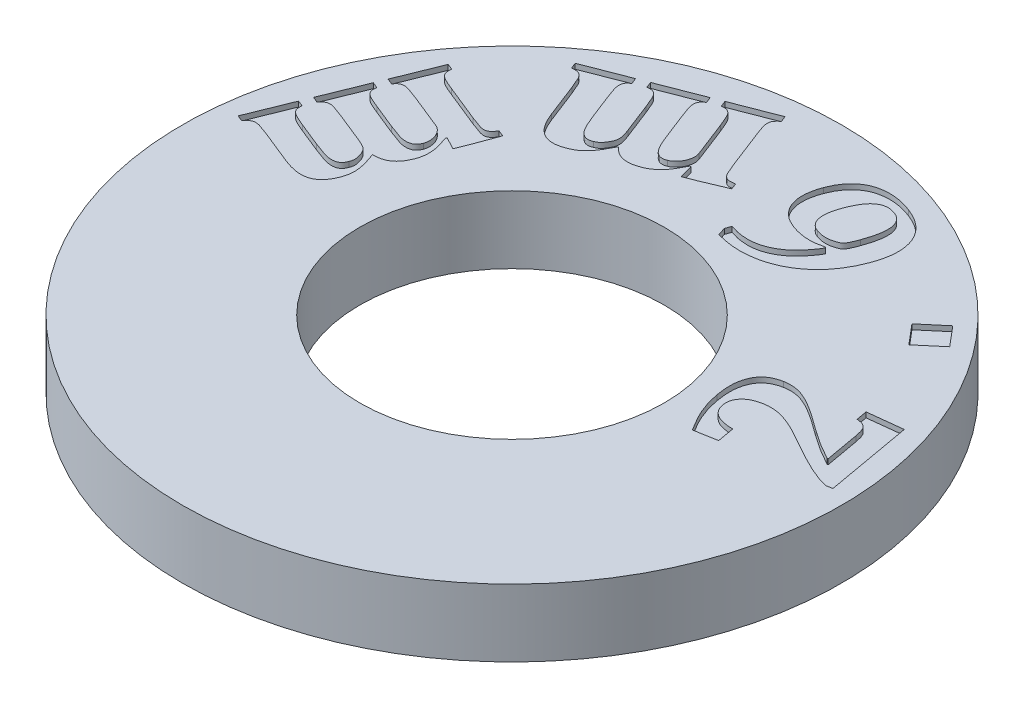
from build123d import *

# Parameters (mm, degrees)
SKETCH1_R           = 12.7
BOSS_EXTRUDE1_DEPTH = 2.6
SKETCH2_R           = 5.8674
CUT_EXTRUDE1_DEPTH  = 19.14772713
CUT_EXTRUDE2_DEPTH  = 0.2


with BuildPart() as part:
    # Sketch1 → Boss-Extrude1 (new body)
    with BuildSketch(Plane(origin=(0, 0, 0), x_dir=(1, 0, 0), z_dir=(0, 1, 0))):
        with Locations(Location((0, 0, 0), (0, 0, 270))):
            Circle(SKETCH1_R)
    extrude(amount=BOSS_EXTRUDE1_DEPTH)

    # Sketch2 → Cut-Extrude1 (cut, through all)
    with BuildSketch(Plane(origin=(0, 0, 0), x_dir=(-1, 0, 0), z_dir=(0, -1, 0))):
        with Locations(Location((0, 0, 0), (0, 0, 90))):
            Circle(SKETCH2_R)
    extrude(amount=-CUT_EXTRUDE1_DEPTH, mode=Mode.SUBTRACT)

    # Sketch4 → Cut-Extrude2 (cut)
    # profile 1 of 5: a face of its own
    with BuildSketch(Plane(origin=(0, 2.6, 0), x_dir=(1, 0, 0), z_dir=(0, 1, 0))):
        with BuildLine():
            add(Edge.make_bspline(
                [(10.657175979, 2.594019097), (10.65013064, 2.630831583), (10.636969406, 2.699600141), (10.614138172, 2.794705295), (10.589733244, 2.874375061), (10.561272904, 2.939067494), (10.531020983, 2.99353319), (10.494812939, 3.038568652), (10.452899957, 3.075923763), (10.405274192, 3.106357847), (10.349988215, 3.13102197), (10.285264647, 3.148965447), (10.210866978, 3.163737215), (10.157483095, 3.168212073), (10.129111743, 3.170590278)],
                knots=[0, 0, 0, 0, 1.540311631, 2.877420744, 4.019047234, 4.959142214, 5.777829076, 6.572764425, 7.321593786, 8.075735676, 8.887004588, 9.799891039, 10.830732, 12, 12, 12, 12], degree=3))
            Line((10.129111743, 3.170590278), (10.054146465, 3.590616319))
            Line((10.054146465, 3.590616319), (11.377063132, 3.739444444))
            Line((11.377063132, 3.739444444), (11.972375632, 0.394670139))
            Line((11.972375632, 0.394670139), (11.73094334, 0.351675347))
            add(Edge.make_bspline(
                [(11.73094334, 0.351675347), (11.666021298, 0.368480839), (11.531212131, 0.403377067), (11.326414737, 0.474445449), (11.110180307, 0.559425855), (10.882988887, 0.660070864), (10.645158868, 0.776715276), (10.394395938, 0.905922065), (10.131048372, 1.048986702), (9.9528541, 1.151989425), (9.861221118, 1.204956597)],
                knots=[0, 0, 0, 0, 0.780349875, 1.620379058, 2.521161756, 3.484490423, 4.511830184, 5.604229563, 6.768021061, 8, 8, 8, 8], degree=3))
            add(Edge.make_bspline(
                [(9.861221118, 1.204956597), (9.776443058, 1.253652173), (9.615930318, 1.345848907), (9.387059411, 1.473484458), (9.181803351, 1.579516376), (8.998168575, 1.667527983), (8.830111188, 1.739289307), (8.671736429, 1.799305225), (8.518737568, 1.8433924), (8.371972803, 1.879309741), (8.228064992, 1.900559713), (8.085286383, 1.908174145), (7.94232826, 1.903319711), (7.848085123, 1.889024598), (7.80077841, 1.881848958)],
                knots=[0, 0, 0, 0, 1.588748718, 3.008023671, 4.257940554, 5.342391522, 6.316243066, 7.226933507, 8.092329584, 8.902015177, 9.680651395, 10.452110241, 11.223014214, 12, 12, 12, 12], degree=3))
            add(Edge.make_bspline(
                [(7.80077841, 1.881848958), (7.737810367, 1.868570311), (7.617604939, 1.843221491), (7.453187274, 1.778906093), (7.312606985, 1.697337928), (7.217707497, 1.610851073), (7.156248473, 1.534763117), (7.11835972, 1.475393068), (7.090083841, 1.412684467), (7.066648765, 1.348152535), (7.054692086, 1.279597589), (7.047209551, 1.208811476), (7.049839269, 1.135133242), (7.057246716, 1.085833888), (7.061047507, 1.060538194)],
                knots=[0, 0, 0, 0, 1.856671383, 3.544368997, 5.077513395, 6.528031651, 7.222788016, 7.900293924, 8.555813474, 9.207192858, 9.877674324, 10.560153428, 11.261209002, 12, 12, 12, 12], degree=3))
            add(Edge.make_bspline(
                [(7.061047507, 1.060538194), (7.071502485, 1.013917266), (7.091847681, 0.923193798), (7.156333505, 0.800294722), (7.242613348, 0.694498267), (7.333740463, 0.622353436), (7.417801846, 0.575049385), (7.488441553, 0.542731657), (7.566717952, 0.516901122), (7.650772556, 0.493347798), (7.742391153, 0.476481532), (7.840439275, 0.461498893), (7.945805633, 0.453265626), (8.018314011, 0.450968067), (8.055439868, 0.449791667)],
                knots=[0, 0, 0, 0, 1.33944009, 2.606525719, 3.862934898, 5.158019576, 5.84800628, 6.574523544, 7.339672684, 8.164919944, 9.0287774, 9.958789578, 10.954856145, 12, 12, 12, 12], degree=3))
            Line((8.055439868, 0.449791667), (8.172297507, -0.207256944))
            Line((8.172297507, -0.207256944), (7.310196812, -0.360494792))
            add(Edge.make_bspline(
                [(7.310196812, -0.360494792), (7.269943559, -0.295206555), (7.194332463, -0.172570127), (7.091280305, 0.001165699), (7.007559915, 0.153805397), (6.917495892, 0.325751817), (6.828566235, 0.528709765), (6.734746947, 0.771533586), (6.660981212, 1.028705946), (6.626054599, 1.207222275), (6.607948548, 1.299765625)],
                knots=[0, 0, 0, 0, 1.013852355, 1.904404784, 2.669660784, 3.314893955, 4.4694696, 5.596276395, 6.753903144, 8, 8, 8, 8], degree=3))
            add(Edge.make_bspline(
                [(6.607948548, 1.299765625), (6.594373085, 1.385581768), (6.568481438, 1.549253623), (6.554034422, 1.786495935), (6.559902757, 2.002451995), (6.590743901, 2.197205894), (6.641439791, 2.370424151), (6.708565837, 2.523254421), (6.792300347, 2.655975238), (6.896085737, 2.76542574), (7.014232975, 2.855427337), (7.146085533, 2.927207536), (7.290765983, 2.983855708), (7.39392888, 3.005259932), (7.446898201, 3.01625)],
                knots=[0, 0, 0, 0, 1.443267886, 2.752656116, 3.944361917, 5.026747142, 6.020055427, 6.935958526, 7.793169878, 8.6141069, 9.428864088, 10.251639209, 11.102298531, 12, 12, 12, 12], degree=3))
            add(Edge.make_bspline(
                [(7.446898201, 3.01625), (7.494563647, 3.02346036), (7.588424347, 3.037658685), (7.729716904, 3.04210554), (7.868111573, 3.030406083), (8.006902768, 3.006267175), (8.149697995, 2.963320645), (8.302330261, 2.904522597), (8.466281885, 2.826207866), (8.611654299, 2.748407674), (8.737278614, 2.673549672), (8.844909038, 2.607699414), (8.96123916, 2.529289408), (9.090383567, 2.444265965), (9.229102901, 2.348034363), (9.378074292, 2.241872945), (9.537955368, 2.126144512), (9.647783356, 2.045099111), (9.704675979, 2.003116319)],
                knots=[0, 0, 0, 0, 0.908484052, 1.788946884, 2.657881961, 3.523717051, 4.440330464, 5.464678491, 6.605413212, 7.864114422, 8.572400302, 9.362740296, 10.242957687, 11.217337518, 12.278341761, 13.426209815, 14.666736238, 16, 16, 16, 16], degree=3))
            add(Edge.make_bspline(
                [(9.704675979, 2.003116319), (9.811805931, 1.92809611), (10.023407319, 1.779917378), (10.291371818, 1.609086139), (10.497607624, 1.48887768), (10.631292817, 1.409907135), (10.747529002, 1.346035088), (10.818829378, 1.308148721), (10.851203757, 1.290946181)],
                knots=[0, 0, 0, 0, 1.742825355, 3.442401069, 4.232730782, 4.923996937, 5.511434123, 6, 6, 6, 6], degree=3))
            Line((10.851203757, 1.290946181), (10.887583965, 1.297560764))
            Line((10.887583965, 1.297560764), (10.657175979, 2.594019097))
        make_face()
    # profile 2 of 5: a face of its own
    with BuildSketch(Plane(origin=(0, 2.6, 0), x_dir=(1, 0, 0), z_dir=(0, 1, 0))):
        Polygon((7.998334498, 7.413598887), (8.851615748, 8.134588471), (9.493230331, 7.375013818), (8.639949081, 6.654024235), align=None)
    # profile 3 of 5: a face of its own
    with BuildSketch(Plane(origin=(0, 2.6, 0), x_dir=(1, 0, 0), z_dir=(0, 1, 0))):
        with BuildLine():
            Line((1.200452366, 6.983777969), (1.280929797, 7.199854358))
            add(Edge.make_bspline(
                [(1.280929797, 7.199854358), (1.343817795, 7.179261353), (1.467155686, 7.138873713), (1.654011169, 7.098413309), (1.836977253, 7.07493453), (2.015597423, 7.068035969), (2.190562747, 7.078072145), (2.361694864, 7.104178741), (2.529159758, 7.148459834), (2.691452106, 7.211129672), (2.849876645, 7.288087424), (3.00262888, 7.382899312), (3.150358517, 7.492976917), (3.291751018, 7.620066885), (3.42880272, 7.760899591), (3.558935253, 7.919039208), (3.685331048, 8.091932582), (3.761884595, 8.216465585), (3.801086047, 8.280236302)],
                knots=[0, 0, 0, 0, 1.055048788, 2.0691944, 3.044229261, 3.994526873, 4.916374231, 5.835814113, 6.751508959, 7.673635849, 8.606948974, 9.557047682, 10.537179467, 11.541963796, 12.586653235, 13.668953384, 14.806320344, 16, 16, 16, 16], degree=3))
            Line((3.801086047, 8.280236302), (3.770217991, 8.307797066))
            add(Edge.make_bspline(
                [(3.770217991, 8.307797066), (3.71414798, 8.294562398), (3.604496336, 8.268680414), (3.440218512, 8.243045281), (3.280238818, 8.230703616), (3.12312468, 8.231653016), (2.966792107, 8.24638583), (2.809094217, 8.274242223), (2.648638057, 8.314787763), (2.542955388, 8.351804744), (2.489193686, 8.370635608)],
                knots=[0, 0, 0, 0, 1.05963004, 2.072233846, 3.055361679, 4.0086536, 4.959232627, 5.940685308, 6.95240852, 8, 8, 8, 8], degree=3))
            add(Edge.make_bspline(
                [(2.489193686, 8.370635608), (2.425678851, 8.396737335), (2.302249784, 8.447461105), (2.132920474, 8.545831273), (1.986886121, 8.662813599), (1.863257967, 8.795473288), (1.764751057, 8.943805026), (1.688468588, 9.103519705), (1.639308535, 9.275732636), (1.612688242, 9.457753868), (1.611225732, 9.648604645), (1.633351871, 9.846131474), (1.675600618, 10.050562667), (1.722178032, 10.185318726), (1.746155491, 10.254689427)],
                knots=[0, 0, 0, 0, 1.077595584, 2.094103196, 3.062986482, 4.006354381, 4.929902502, 5.848931818, 6.774838988, 7.731371815, 8.729829957, 9.762912156, 10.848375697, 12, 12, 12, 12], degree=3))
            add(Edge.make_bspline(
                [(1.746155491, 10.254689427), (1.7763527, 10.329017713), (1.835212514, 10.473896968), (1.951299256, 10.672660048), (2.085665588, 10.848945539), (2.213804547, 10.97741434), (2.326332688, 11.065860187), (2.414590439, 11.126148678), (2.508811454, 11.177493313), (2.606907441, 11.223070875), (2.710126865, 11.260830416), (2.818355474, 11.290046763), (2.930920772, 11.313549546), (3.048111242, 11.328816613), (3.169265694, 11.336319095), (3.294130713, 11.336644782), (3.422555278, 11.327106532), (3.55443731, 11.311041992), (3.689828281, 11.285147679), (3.828062677, 11.250881114), (3.970010998, 11.208775039), (4.064699677, 11.175620405), (4.113073894, 11.158682483)],
                knots=[0, 0, 0, 0, 1.672877526, 3.260740491, 4.787171376, 6.289516588, 7.032212332, 7.772527889, 8.517517252, 9.269110702, 10.028607479, 10.808285605, 11.607046719, 12.427139982, 13.272559756, 14.139283271, 15.03113053, 15.958707747, 16.910946222, 17.906201506, 18.93032764, 20, 20, 20, 20], degree=3))
            add(Edge.make_bspline(
                [(4.113073894, 11.158682483), (4.15697111, 11.141450954), (4.243422618, 11.107515052), (4.368170705, 11.050419534), (4.484996173, 10.987386071), (4.59493391, 10.920003123), (4.697245283, 10.847353308), (4.79277647, 10.769806838), (4.880831456, 10.687287685), (4.961582993, 10.600024174), (5.034609675, 10.508303615), (5.099779246, 10.41208411), (5.157520331, 10.31176066), (5.205939239, 10.20638206), (5.246771826, 10.09693552), (5.280219809, 9.983207721), (5.303980564, 9.864730901), (5.320880501, 9.742517717), (5.328043678, 9.616488704), (5.328305305, 9.48689334), (5.319416583, 9.353933132), (5.301199014, 9.21787529), (5.276088854, 9.078654194), (5.241524935, 8.936320611), (5.198718022, 8.790527437), (5.163826853, 8.693479882), (5.146051325, 8.644038385)],
                knots=[0, 0, 0, 0, 1.098191461, 2.162786548, 3.192832132, 4.188048845, 5.164054587, 6.113082797, 7.051594597, 7.972179555, 8.879742853, 9.779402692, 10.67641257, 11.572442019, 12.476973698, 13.395128669, 14.330043427, 15.288670823, 16.266176383, 17.267519822, 18.30535816, 19.36692158, 20.463110258, 21.598586896, 22.776584751, 24, 24, 24, 24], degree=3))
            add(Edge.make_bspline(
                [(5.146051325, 8.644038385), (5.120410458, 8.577547881), (5.069504659, 8.445541726), (4.979642143, 8.255748764), (4.882591907, 8.073477), (4.7757546, 7.901071263), (4.66050112, 7.736651354), (4.536347737, 7.581334242), (4.401952184, 7.435476143), (4.260695193, 7.298015339), (4.111468893, 7.171081941), (3.956153925, 7.054726669), (3.793202875, 6.951568523), (3.625965791, 6.857262903), (3.452169721, 6.775166977), (3.271848517, 6.706482366), (3.086418619, 6.645984938), (2.895066533, 6.599208672), (2.700286371, 6.564048118), (2.50372428, 6.540540621), (2.305560774, 6.530620344), (2.106360141, 6.534210416), (1.905755587, 6.549850704), (1.704278713, 6.57711169), (1.501495309, 6.618153508), (1.367468793, 6.65450437), (1.299671116, 6.672892552)],
                knots=[0, 0, 0, 0, 1.070823632, 2.125947334, 3.153976389, 4.173332704, 5.172465224, 6.170528418, 7.159609897, 8.15178657, 9.131336938, 10.102378564, 11.066150857, 12.028085339, 12.986779263, 13.952022445, 14.926733186, 15.916739616, 16.91025301, 17.90025944, 18.890219644, 19.890115268, 20.892859756, 21.913053768, 22.944312598, 24, 24, 24, 24], degree=3))
            Line((1.299671116, 6.672892552), (1.200452366, 6.983777969))
        make_face()
        with BuildLine():
            add(Edge.make_bspline(
                [(3.076789172, 8.698057483), (3.132909456, 8.679932439), (3.243010075, 8.644373488), (3.413032857, 8.625283629), (3.576075832, 8.63331494), (3.704133547, 8.658205157), (3.795432605, 8.686357261), (3.852529709, 8.707316756), (3.898519111, 8.728016151), (3.948692476, 8.75488002), (4.001805532, 8.805818747), (4.047266948, 8.872729684), (4.084461884, 8.946478634), (4.119923668, 9.023856133), (4.158569665, 9.121872517), (4.186258552, 9.19376456), (4.201268339, 9.232736302)],
                knots=[0, 0, 0, 0, 1.710541778, 3.355858038, 4.938271646, 6.440062148, 7.13262002, 7.713873542, 8.206199276, 8.598318393, 9.361997601, 10.313061428, 10.938824559, 11.760841173, 12.786181087, 14, 14, 14, 14], degree=3))
            add(Edge.make_bspline(
                [(4.201268339, 9.232736302), (4.219616657, 9.284432015), (4.255072374, 9.384327197), (4.30105685, 9.531510269), (4.335960436, 9.671161482), (4.362974871, 9.803145166), (4.381080853, 9.927152769), (4.388903885, 10.043638718), (4.388039482, 10.152006568), (4.378848483, 10.252989558), (4.358648581, 10.346021304), (4.330820471, 10.43180026), (4.290949714, 10.508625418), (4.24422561, 10.579514316), (4.184064175, 10.639885789), (4.116891173, 10.694879513), (4.038769365, 10.7401109), (3.982187335, 10.763211055), (3.953221464, 10.775036649)],
                knots=[0, 0, 0, 0, 1.500894568, 2.900281813, 4.217152542, 5.437764563, 6.585289063, 7.643385764, 8.628806701, 9.548256839, 10.412033135, 11.229197673, 12.007129352, 12.774066827, 13.542058149, 14.328777375, 15.144455933, 16, 16, 16, 16], degree=3))
            add(Edge.make_bspline(
                [(3.953221464, 10.775036649), (3.919245977, 10.786364872), (3.853943728, 10.80813817), (3.75608292, 10.828911875), (3.662442482, 10.834694319), (3.573482634, 10.826592591), (3.488865702, 10.807977138), (3.408458099, 10.777657234), (3.332269753, 10.736631897), (3.260047544, 10.685155263), (3.191439608, 10.624053207), (3.126309215, 10.552989981), (3.064446481, 10.472120724), (2.985796284, 10.348662157), (2.892809985, 10.174619164), (2.834135004, 10.024617309), (2.803386394, 9.946008871)],
                knots=[0, 0, 0, 0, 0.932873925, 1.793021151, 2.598839487, 3.367856657, 4.113627244, 4.849993345, 5.599749579, 6.36230028, 7.155964143, 7.989527263, 8.87058289, 9.805567893, 11.801908814, 14, 14, 14, 14], degree=3))
            add(Edge.make_bspline(
                [(2.803386394, 9.946008871), (2.789021343, 9.905717802), (2.761142699, 9.82752383), (2.727163126, 9.711565588), (2.69985937, 9.601384176), (2.682829992, 9.496212874), (2.670852833, 9.39695612), (2.668292805, 9.303160591), (2.675472645, 9.215066626), (2.688060026, 9.132630092), (2.708521729, 9.055609287), (2.739278462, 8.985918652), (2.775041981, 8.920834938), (2.820963864, 8.863655968), (2.873499986, 8.812178352), (2.933526127, 8.766434912), (3.002012742, 8.728007435), (3.051553194, 8.708165164), (3.076789172, 8.698057483)],
                knots=[0, 0, 0, 0, 1.424088551, 2.763767271, 4.022183305, 5.201039714, 6.30911801, 7.349523498, 8.319005133, 9.248428938, 10.124185317, 10.962911168, 11.779474492, 12.589779123, 13.394520957, 14.224182145, 15.095395788, 16, 16, 16, 16], degree=3))
        make_face(mode=Mode.SUBTRACT)
    # profile 4 of 5: a face of its own
    with BuildSketch(Plane(origin=(0, 2.6, 0), x_dir=(1, 0, 0), z_dir=(0, 1, 0))):
        with BuildLine():
            Line((-1.500499582, 8.398806621), (-1.545699235, 8.394396899))
            add(Edge.make_bspline(
                [(-1.545699235, 8.394396899), (-1.578680129, 8.328177935), (-1.64156419, 8.201919461), (-1.744030648, 8.02884167), (-1.846044886, 7.880084841), (-1.949946333, 7.754727011), (-2.05857315, 7.650318657), (-2.17357881, 7.562688436), (-2.294646542, 7.48709386), (-2.38188138, 7.450331118), (-2.425438818, 7.431975024)],
                knots=[0, 0, 0, 0, 1.327248858, 2.530640849, 3.606312378, 4.561298934, 5.447501221, 6.30354898, 7.15294094, 8, 8, 8, 8], degree=3))
            add(Edge.make_bspline(
                [(-2.425438818, 7.431975024), (-2.466711164, 7.416501822), (-2.546064862, 7.386751738), (-2.664025189, 7.356362389), (-2.774202536, 7.336715383), (-2.877415506, 7.329477021), (-2.975012839, 7.335492968), (-3.068194376, 7.350780271), (-3.158059284, 7.376341345), (-3.244768044, 7.411813357), (-3.328951411, 7.458526601), (-3.408552551, 7.519497131), (-3.489562903, 7.588502591), (-3.538054885, 7.643001758), (-3.563147151, 7.671202454)],
                knots=[0, 0, 0, 0, 1.261849166, 2.426137807, 3.483538902, 4.464561663, 5.381899843, 6.278343648, 7.164718223, 8.052217243, 8.957088943, 9.91293841, 10.920046081, 12, 12, 12, 12], degree=3))
            add(Edge.make_bspline(
                [(-3.563147151, 7.671202454), (-3.599531182, 7.59843004), (-3.668389116, 7.460705936), (-3.777147706, 7.27123298), (-3.885029972, 7.111206789), (-3.99057811, 6.976050247), (-4.102053829, 6.86480688), (-4.219976724, 6.770641123), (-4.348199055, 6.69203994), (-4.439779694, 6.652578048), (-4.485881526, 6.632712871)],
                knots=[0, 0, 0, 0, 1.370148351, 2.593049264, 3.676206861, 4.618613109, 5.476374145, 6.322127868, 7.155356622, 8, 8, 8, 8], degree=3))
            add(Edge.make_bspline(
                [(-4.485881526, 6.632712871), (-4.530445251, 6.616076964), (-4.615952839, 6.584156465), (-4.743101562, 6.551526654), (-4.861772979, 6.530294812), (-4.973189572, 6.524827778), (-5.078684173, 6.531644554), (-5.178538203, 6.555233414), (-5.275449977, 6.587065021), (-5.366578661, 6.635862424), (-5.452894115, 6.696968271), (-5.534744327, 6.770753064), (-5.613569564, 6.855921676), (-5.687290851, 6.95508305), (-5.757960734, 7.067347228), (-5.826043906, 7.19293182), (-5.891036555, 7.332819596), (-5.93122393, 7.431428083), (-5.952114165, 7.482686829)],
                knots=[0, 0, 0, 0, 1.164238848, 2.233907847, 3.210467445, 4.111618036, 4.95998529, 5.789768502, 6.618037198, 7.451375979, 8.310370773, 9.20280479, 10.145472204, 11.148103074, 12.224265042, 13.392220349, 14.64442181, 16, 16, 16, 16], degree=3))
            Line((-5.952114165, 7.482686829), (-6.443798193, 8.752686829))
            add(Edge.make_bspline(
                [(-6.443798193, 8.752686829), (-6.46298886, 8.80204742), (-6.500138469, 8.897600464), (-6.557518406, 9.031550001), (-6.610596713, 9.14701544), (-6.6652213, 9.236719574), (-6.719195792, 9.30301382), (-6.776882541, 9.349899558), (-6.841998121, 9.381410269), (-6.91741995, 9.396764093), (-7.003583166, 9.400735532), (-7.06413052, 9.395102303), (-7.096437082, 9.392096552)],
                knots=[0, 0, 0, 0, 1.559140996, 3.018210822, 4.290952874, 5.296787436, 6.103062558, 6.795868098, 7.468525882, 8.211398264, 9.045646607, 10, 10, 10, 10], degree=3))
            Line((-7.096437082, 9.392096552), (-7.185733957, 9.621402107))
            Line((-7.185733957, 9.621402107), (-5.508937082, 10.271836135))
            Line((-5.508937082, 10.271836135), (-5.419640207, 10.042530579))
            add(Edge.make_bspline(
                [(-5.419640207, 10.042530579), (-5.44126826, 10.026399982), (-5.481650493, 9.996282175), (-5.533846741, 9.947929725), (-5.570951767, 9.898212078), (-5.594627254, 9.847372575), (-5.604920024, 9.794555745), (-5.609329846, 9.738344691), (-5.607052869, 9.676900081), (-5.596124222, 9.607106489), (-5.574701737, 9.523170129), (-5.540686924, 9.418742082), (-5.495430219, 9.289738424), (-5.459929128, 9.196145913), (-5.440586387, 9.145152107)],
                knots=[0, 0, 0, 0, 0.976263073, 1.822803084, 2.564919562, 3.207680077, 3.833713685, 4.500778585, 5.245986733, 6.052842077, 7.052732165, 8.377616694, 10.026347317, 12, 12, 12, 12], degree=3))
            Line((-5.440586387, 9.145152107), (-5.077886735, 8.212495857))
            add(Edge.make_bspline(
                [(-5.077886735, 8.212495857), (-5.058213378, 8.162818328), (-5.020773209, 8.068277516), (-4.964958774, 7.935032266), (-4.911566849, 7.817607376), (-4.862407323, 7.714442109), (-4.814206633, 7.625009471), (-4.764214553, 7.549826783), (-4.714948421, 7.485912263), (-4.663879121, 7.434812521), (-4.612373766, 7.394089192), (-4.560879865, 7.363706829), (-4.510177119, 7.340304693), (-4.45834347, 7.326789669), (-4.404290481, 7.322415505), (-4.347102358, 7.327322637), (-4.286499427, 7.340839251), (-4.245784961, 7.355102318), (-4.224605485, 7.362521899)],
                knots=[0, 0, 0, 0, 1.886072366, 3.589365554, 5.098767554, 6.438935382, 7.62327005, 8.680997452, 9.623029443, 10.466885591, 11.224590498, 11.934248244, 12.573028465, 13.189694188, 13.814492117, 14.478078476, 15.208303495, 16, 16, 16, 16], degree=3))
            add(Edge.make_bspline(
                [(-4.224605485, 7.362521899), (-4.196124879, 7.375107043), (-4.140617846, 7.399634753), (-4.06647594, 7.453951996), (-4.002096369, 7.521299194), (-3.946506985, 7.600529328), (-3.897145713, 7.683379182), (-3.857845601, 7.766968153), (-3.829112457, 7.850147785), (-3.819086508, 7.936966256), (-3.820853325, 8.026934807), (-3.836167036, 8.105507556), (-3.855045624, 8.176985637), (-3.877649694, 8.244743013), (-3.906253353, 8.326857924), (-3.92895999, 8.385647919), (-3.941280832, 8.41754794)],
                knots=[0, 0, 0, 0, 1.05712718, 2.060278967, 3.103930472, 4.214663213, 5.347149753, 6.382223774, 7.355140304, 8.326206341, 9.339519046, 10.406659634, 11.040664636, 11.855394827, 12.836316401, 14, 14, 14, 14], degree=3))
            Line((-3.941280832, 8.41754794), (-4.381150624, 9.551948982))
            add(Edge.make_bspline(
                [(-4.381150624, 9.551948982), (-4.395843684, 9.589066049), (-4.42322045, 9.65822422), (-4.461713942, 9.755215287), (-4.496936471, 9.837422587), (-4.535923805, 9.924848545), (-4.581174005, 10.013011645), (-4.639853073, 10.097027896), (-4.70584835, 10.158300648), (-4.770957186, 10.189348355), (-4.82925529, 10.203846904), (-4.881158179, 10.209027832), (-4.940539071, 10.208514609), (-4.982726237, 10.205229651), (-5.005126318, 10.20348544)],
                knots=[0, 0, 0, 0, 1.43593228, 2.675492938, 3.753329024, 4.652559938, 6.11901344, 7.311444819, 8.322447917, 9.321542641, 9.866545793, 10.478167495, 11.191953967, 12, 12, 12, 12], degree=3))
            Line((-5.005126318, 10.20348544), (-5.094423193, 10.432790996))
            Line((-5.094423193, 10.432790996), (-3.438572499, 11.074405579))
            Line((-3.438572499, 11.074405579), (-3.349275624, 10.845100024))
            add(Edge.make_bspline(
                [(-3.349275624, 10.845100024), (-3.371829284, 10.829185098), (-3.413734166, 10.799615038), (-3.465251913, 10.749034653), (-3.503876703, 10.69980329), (-3.528520914, 10.648919497), (-3.540482433, 10.595811986), (-3.544340482, 10.539416273), (-3.542185737, 10.47838512), (-3.531505961, 10.409501208), (-3.508063178, 10.326746257), (-3.474739068, 10.222065038), (-3.429638126, 10.092106636), (-3.393324208, 9.997946719), (-3.373529096, 9.946619121)],
                knots=[0, 0, 0, 0, 0.992957471, 1.844922954, 2.591631667, 3.237113429, 3.86329802, 4.54058269, 5.269232777, 6.059395145, 7.045266299, 8.364235463, 10.018105088, 12, 12, 12, 12], degree=3))
            Line((-3.373529096, 9.946619121), (-3.010829443, 9.013962871))
            add(Edge.make_bspline(
                [(-3.010829443, 9.013962871), (-2.996657788, 8.977151092), (-2.969516159, 8.906648973), (-2.928004225, 8.806398578), (-2.891454916, 8.714556702), (-2.844654724, 8.610739499), (-2.791764113, 8.500780224), (-2.730333993, 8.390242101), (-2.666711658, 8.305624809), (-2.604799685, 8.236574129), (-2.538315851, 8.186697449), (-2.473039115, 8.148601797), (-2.403922676, 8.128561555), (-2.329787806, 8.121444181), (-2.246708712, 8.132336889), (-2.1910254, 8.152150967), (-2.160855485, 8.162886482)],
                knots=[0, 0, 0, 0, 1.218376668, 2.33344156, 3.351562828, 4.271279059, 5.850097088, 7.121466675, 8.168044415, 9.115705124, 9.973893436, 10.725810247, 11.436861629, 12.177817345, 13.012718608, 14, 14, 14, 14], degree=3))
            add(Edge.make_bspline(
                [(-2.160855485, 8.162886482), (-2.139651487, 8.17267279), (-2.096037015, 8.192802233), (-2.034047516, 8.233544001), (-1.97680789, 8.28717359), (-1.920611109, 8.347803533), (-1.870920225, 8.417558281), (-1.828079155, 8.49341736), (-1.795216046, 8.575437602), (-1.771331247, 8.661942034), (-1.756280888, 8.749896331), (-1.755281747, 8.83758026), (-1.766801807, 8.92340652), (-1.78547311, 8.977820506), (-1.79484854, 9.005143427)],
                knots=[0, 0, 0, 0, 0.836243377, 1.720067758, 2.64304706, 3.640427864, 4.67827718, 5.704026804, 6.755486752, 7.835339964, 8.915594534, 9.942780013, 10.967007125, 12, 12, 12, 12], degree=3))
            Line((-1.79484854, 9.005143427), (-2.317400624, 10.352313565))
            add(Edge.make_bspline(
                [(-2.317400624, 10.352313565), (-2.337449883, 10.40272207), (-2.374297839, 10.495366407), (-2.426816724, 10.620893065), (-2.471793057, 10.720796935), (-2.510807835, 10.798084427), (-2.54947846, 10.857414013), (-2.587241421, 10.906814316), (-2.629873376, 10.945553523), (-2.675175925, 10.977219168), (-2.728120542, 10.998709343), (-2.789785301, 11.010093904), (-2.861054931, 11.0134522), (-2.911278956, 11.00790917), (-2.938069026, 11.004952454)],
                knots=[0, 0, 0, 0, 1.95560344, 3.594147164, 4.904245662, 5.905587673, 6.710271926, 7.455046029, 8.139409163, 8.778697916, 9.437986146, 10.180991047, 11.02971977, 12, 12, 12, 12], degree=3))
            Line((-2.938069026, 11.004952454), (-3.027365901, 11.23425801))
            Line((-3.027365901, 11.23425801), (-1.360490901, 11.880282315))
            Line((-1.360490901, 11.880282315), (-1.271194026, 11.65097676))
            add(Edge.make_bspline(
                [(-1.271194026, 11.65097676), (-1.294464177, 11.633544837), (-1.337723243, 11.601139), (-1.391337788, 11.547318124), (-1.431986317, 11.49598486), (-1.45922466, 11.443955182), (-1.473163029, 11.3904295), (-1.479948266, 11.334042404), (-1.478351478, 11.2732882), (-1.469043519, 11.204391579), (-1.446753676, 11.121913989), (-1.414774149, 11.018105936), (-1.368617134, 10.890236847), (-1.333428141, 10.796908086), (-1.314188818, 10.745881274)],
                knots=[0, 0, 0, 0, 1.037135948, 1.928029266, 2.705015774, 3.368269828, 4.008263075, 4.669175765, 5.391120458, 6.172527977, 7.146544743, 8.437585155, 10.052275959, 12, 12, 12, 12], degree=3))
            Line((-1.314188818, 10.745881274), (-0.759666249, 9.316028843))
            add(Edge.make_bspline(
                [(-0.759666249, 9.316028843), (-0.743921112, 9.275951927), (-0.714551879, 9.201196888), (-0.672985784, 9.097792191), (-0.636647661, 9.011772902), (-0.597587967, 8.923591054), (-0.551084166, 8.837162329), (-0.490114353, 8.754815403), (-0.417614899, 8.699473063), (-0.347881536, 8.672373402), (-0.282522669, 8.66399496), (-0.221567487, 8.665129956), (-0.1486079, 8.670552639), (-0.096688113, 8.678765615), (-0.06844229, 8.683233704)],
                knots=[0, 0, 0, 0, 1.450579982, 2.705751189, 3.754223165, 4.596399602, 5.953928095, 7.055990142, 8.019135306, 8.987042258, 9.536785458, 10.230042737, 11.037093544, 12, 12, 12, 12], degree=3))
            Line((-0.06844229, 8.683233704), (0.023059446, 8.446211135))
            Line((0.023059446, 8.446211135), (-0.919518679, 8.048233704))
            Line((-0.919518679, 8.048233704), (-1.35828604, 7.878459399))
            Line((-1.35828604, 7.878459399), (-1.500499582, 8.398806621))
        make_face()
    # profile 5 of 5: a face of its own
    with BuildSketch(Plane(origin=(0, 2.6, 0), x_dir=(1, 0, 0), z_dir=(0, 1, 0))):
        with BuildLine():
            Line((-7.16368149, 4.664663168), (-7.190139823, 4.626078099))
            add(Edge.make_bspline(
                [(-7.190139823, 4.626078099), (-7.164649314, 4.55729115), (-7.116159018, 4.42643855), (-7.060406274, 4.234988301), (-7.023567353, 4.059884896), (-7.00352064, 3.899037183), (-7.001186545, 3.748971413), (-7.014304824, 3.605121185), (-7.043445696, 3.465714205), (-7.075877359, 3.377062447), (-7.092023504, 3.332927057)],
                knots=[0, 0, 0, 0, 1.323655474, 2.517974168, 3.594956346, 4.550030047, 5.438835311, 6.298074595, 7.15269428, 8, 8, 8, 8], degree=3))
            add(Edge.make_bspline(
                [(-7.092023504, 3.332927057), (-7.109391964, 3.292567879), (-7.142627793, 3.215337616), (-7.200539997, 3.109008476), (-7.260487173, 3.015474937), (-7.326239511, 2.936063699), (-7.396981172, 2.869399843), (-7.470867554, 2.811013651), (-7.551013684, 2.763937143), (-7.6355474, 2.724328503), (-7.72676892, 2.695727303), (-7.825186481, 2.677359214), (-7.930758256, 2.667037872), (-8.00371313, 2.668508086), (-8.041216212, 2.669263863)],
                knots=[0, 0, 0, 0, 1.263710982, 2.418204165, 3.479912074, 4.456078823, 5.37604635, 6.272872525, 7.159668175, 8.044444074, 8.954083143, 9.901829511, 10.921417382, 12, 12, 12, 12], degree=3))
            add(Edge.make_bspline(
                [(-8.041216212, 2.669263863), (-8.012664087, 2.593533847), (-7.958672874, 2.450330655), (-7.897254148, 2.242338044), (-7.85254913, 2.055967161), (-7.828474389, 1.886937938), (-7.821582298, 1.730088367), (-7.835967702, 1.580047311), (-7.864362196, 1.433331711), (-7.898467654, 1.340098421), (-7.915539129, 1.293430529)],
                knots=[0, 0, 0, 0, 1.370034684, 2.590694547, 3.669965494, 4.612469718, 5.477980982, 6.321354364, 7.159754493, 8, 8, 8, 8], degree=3))
            add(Edge.make_bspline(
                [(-7.915539129, 1.293430529), (-7.933828094, 1.249679925), (-7.968937563, 1.165691549), (-8.032412777, 1.051173337), (-8.098127296, 0.950783898), (-8.169168421, 0.865612476), (-8.246420078, 0.79494002), (-8.330272364, 0.736809993), (-8.42075491, 0.690538837), (-8.517820011, 0.655949713), (-8.620881166, 0.634020694), (-8.730389366, 0.624589087), (-8.845983391, 0.625634916), (-8.968463093, 0.63949925), (-9.097654141, 0.665411655), (-9.234589546, 0.70270052), (-9.380766282, 0.748418167), (-9.479380765, 0.78714462), (-9.530599893, 0.807258654)],
                knots=[0, 0, 0, 0, 1.166157003, 2.238680671, 3.216885827, 4.115430327, 4.960405869, 5.785746922, 6.618928583, 7.454169059, 8.314444076, 9.204437564, 10.154049163, 11.15473713, 12.233078511, 13.393505669, 14.646219497, 16, 16, 16, 16], degree=3))
            Line((-9.530599893, 0.807258654), (-10.788473157, 1.315479141))
            add(Edge.make_bspline(
                [(-10.788473157, 1.315479141), (-10.837198309, 1.335365105), (-10.93189292, 1.374012366), (-11.068701722, 1.422278667), (-11.188218479, 1.464834061), (-11.290776005, 1.48467395), (-11.375475685, 1.492645704), (-11.448840067, 1.482828944), (-11.515458516, 1.455386455), (-11.577987731, 1.411308349), (-11.639513644, 1.351046656), (-11.676868623, 1.303475561), (-11.696875935, 1.277996502)],
                knots=[0, 0, 0, 0, 1.555345476, 3.022727044, 4.290413483, 5.298148995, 6.103883474, 6.795234541, 7.462966408, 8.213258407, 9.043021928, 10, 10, 10, 10], degree=3))
            Line((-11.696875935, 1.277996502), (-11.923976629, 1.369498238))
            Line((-11.923976629, 1.369498238), (-11.253698851, 3.029758654))
            Line((-11.253698851, 3.029758654), (-11.026598157, 2.938256918))
            add(Edge.make_bspline(
                [(-11.026598157, 2.938256918), (-11.029960338, 2.911836404), (-11.036252098, 2.862394837), (-11.033434767, 2.79240084), (-11.025049275, 2.7315848), (-11.004329165, 2.679830814), (-10.973648735, 2.635352947), (-10.936050485, 2.593698422), (-10.890161384, 2.553225869), (-10.831603216, 2.514464236), (-10.756009519, 2.472626088), (-10.656939665, 2.425799437), (-10.532508603, 2.370583843), (-10.439876693, 2.333428213), (-10.389393296, 2.313178793)],
                knots=[0, 0, 0, 0, 0.967159303, 1.809876639, 2.541800689, 3.189784498, 3.816452723, 4.498177879, 5.227655652, 6.036054599, 7.047658258, 8.369166658, 10.021234751, 12, 12, 12, 12], degree=3))
            Line((-10.389393296, 2.313178793), (-9.46555649, 1.939454835))
            add(Edge.make_bspline(
                [(-9.46555649, 1.939454835), (-9.416435453, 1.919663343), (-9.322668242, 1.881883337), (-9.18734965, 1.833023085), (-9.066048718, 1.790442387), (-8.957366929, 1.756626907), (-8.85942748, 1.732245359), (-8.77092797, 1.714460956), (-8.690667974, 1.707752382), (-8.618512686, 1.709648832), (-8.554126568, 1.719571665), (-8.496624311, 1.735804164), (-8.445991571, 1.758412537), (-8.400552882, 1.785931634), (-8.361171178, 1.822733924), (-8.32599669, 1.866972737), (-8.294662925, 1.920259699), (-8.277445532, 1.959460554), (-8.268316907, 1.980244766)],
                knots=[0, 0, 0, 0, 1.878070796, 3.585051825, 5.101820897, 6.437565254, 7.619771183, 8.680584427, 9.635205144, 10.469727393, 11.234690702, 11.940042337, 12.581845515, 13.196613156, 13.814687504, 14.482305303, 15.195321426, 16, 16, 16, 16], degree=3))
            add(Edge.make_bspline(
                [(-8.268316907, 1.980244766), (-8.257534085, 2.009689073), (-8.236657991, 2.066694758), (-8.226074912, 2.157529948), (-8.230994665, 2.250117387), (-8.250700093, 2.344292682), (-8.276670914, 2.436888028), (-8.311695876, 2.521512873), (-8.351553665, 2.599463038), (-8.407820039, 2.665553826), (-8.472844685, 2.726716651), (-8.540547921, 2.768619092), (-8.605705077, 2.80327289), (-8.670466534, 2.83379101), (-8.750396566, 2.86745152), (-8.808146459, 2.891940869), (-8.839375935, 2.905184002)],
                knots=[0, 0, 0, 0, 1.068599134, 2.068862603, 3.100116208, 4.22595035, 5.350943271, 6.381967343, 7.354395825, 8.327473133, 9.332143763, 10.394820174, 11.035447866, 11.855790058, 12.840473138, 14, 14, 14, 14], degree=3))
            Line((-8.839375935, 2.905184002), (-9.962752671, 3.35828296))
            add(Edge.make_bspline(
                [(-9.962752671, 3.35828296), (-9.999481899, 3.373023886), (-10.068383109, 3.400676729), (-10.165061628, 3.438750096), (-10.249327483, 3.467946945), (-10.339095588, 3.499841036), (-10.433888248, 3.52601606), (-10.534459602, 3.542625232), (-10.623541986, 3.535481123), (-10.690147393, 3.509446782), (-10.740536434, 3.476742951), (-10.779725654, 3.442190114), (-10.820605622, 3.398662829), (-10.847127756, 3.365825594), (-10.861233573, 3.348361085)],
                knots=[0, 0, 0, 0, 1.429321889, 2.681298033, 3.75164529, 4.649764094, 6.120981964, 7.299630989, 8.312490044, 9.308162915, 9.845594238, 10.476067727, 11.189495434, 12, 12, 12, 12], degree=3))
            Line((-10.861233573, 3.348361085), (-11.088334268, 3.439862821))
            Line((-11.088334268, 3.439862821), (-10.425773504, 5.080279488))
            Line((-10.425773504, 5.080279488), (-10.19867281, 4.988777752))
            add(Edge.make_bspline(
                [(-10.19867281, 4.988777752), (-10.201858239, 4.961631799), (-10.207829575, 4.910744589), (-10.207140856, 4.838805265), (-10.19770968, 4.776947141), (-10.179195994, 4.723726277), (-10.147745173, 4.679371037), (-10.110751365, 4.637502673), (-10.064112817, 4.598749239), (-10.007231392, 4.558889759), (-9.931144318, 4.519071238), (-9.831850867, 4.472892251), (-9.706557801, 4.417959586), (-9.613382351, 4.379993951), (-9.562570379, 4.359289904)],
                knots=[0, 0, 0, 0, 0.987883534, 1.851864852, 2.592561418, 3.244335589, 3.867287659, 4.544970173, 5.261422686, 6.054072821, 7.053245803, 8.36119061, 10.015624468, 12, 12, 12, 12], degree=3))
            Line((-9.562570379, 4.359289904), (-8.638733573, 3.985565946))
            add(Edge.make_bspline(
                [(-8.638733573, 3.985565946), (-8.602342555, 3.971263897), (-8.532163922, 3.943682962), (-8.431536164, 3.903593616), (-8.338625919, 3.869855838), (-8.254865153, 3.839254486), (-8.177711224, 3.815283931), (-8.10854483, 3.793931764), (-8.045439649, 3.778679486), (-7.973242446, 3.762009696), (-7.890103584, 3.754192271), (-7.798122086, 3.752138733), (-7.716619437, 3.766146747), (-7.644396396, 3.787554258), (-7.581824489, 3.822452219), (-7.527815945, 3.872981313), (-7.47918714, 3.939925785), (-7.455473942, 3.993794839), (-7.442596421, 4.023048585)],
                knots=[0, 0, 0, 0, 1.387864261, 2.676441114, 3.84430266, 4.896286497, 5.84090873, 6.711685298, 7.464586366, 8.145088478, 9.339168239, 10.421756988, 11.399564962, 12.261702271, 13.085184182, 13.916070177, 14.868315879, 16, 16, 16, 16], degree=3))
            add(Edge.make_bspline(
                [(-7.442596421, 4.023048585), (-7.43496743, 4.044919206), (-7.419227741, 4.090041396), (-7.407715803, 4.162997395), (-7.406061599, 4.241064556), (-7.412378632, 4.323228959), (-7.429301397, 4.406950483), (-7.453588567, 4.490709249), (-7.492720292, 4.569957367), (-7.537952794, 4.646781757), (-7.592295953, 4.717403188), (-7.656191247, 4.776941199), (-7.725579248, 4.828485114), (-7.77794394, 4.851542378), (-7.804193643, 4.863100668)],
                knots=[0, 0, 0, 0, 0.831538093, 1.715580859, 2.640822049, 3.634913423, 4.671387569, 5.707861716, 6.759882589, 7.838449821, 8.911500049, 9.948900108, 10.971811692, 12, 12, 12, 12], degree=3))
            Line((-7.804193643, 4.863100668), (-9.138134615, 5.401086779))
            add(Edge.make_bspline(
                [(-9.138134615, 5.401086779), (-9.188050424, 5.421074202), (-9.279847881, 5.457831985), (-9.406256666, 5.506115799), (-9.510320451, 5.539848629), (-9.593239892, 5.565490949), (-9.662819376, 5.578307527), (-9.724573607, 5.583112043), (-9.781839613, 5.580347901), (-9.836038739, 5.568236721), (-9.88708062, 5.543659273), (-9.938099964, 5.50749718), (-9.986725342, 5.455510501), (-10.01784493, 5.415676709), (-10.034410657, 5.394472196)],
                knots=[0, 0, 0, 0, 1.944520183, 3.576061564, 4.891378439, 5.900798065, 6.711411268, 7.444222383, 8.136385948, 8.777834455, 9.437737867, 10.171512257, 11.026650744, 12, 12, 12, 12], degree=3))
            Line((-10.034410657, 5.394472196), (-10.261511351, 5.485973932))
            Line((-10.261511351, 5.485973932), (-9.595643296, 7.136312474))
            Line((-9.595643296, 7.136312474), (-9.368542601, 7.044810738))
            add(Edge.make_bspline(
                [(-9.368542601, 7.044810738), (-9.371377434, 7.016182856), (-9.376677447, 6.962660086), (-9.374845864, 6.887080155), (-9.364481824, 6.822666159), (-9.345267593, 6.767911152), (-9.316385209, 6.721215277), (-9.278746054, 6.679352103), (-9.234893916, 6.638032809), (-9.178125407, 6.59847711), (-9.103069033, 6.558604484), (-9.005374757, 6.510925974), (-8.881286876, 6.456523365), (-8.789133837, 6.419115263), (-8.739054754, 6.398786432)],
                knots=[0, 0, 0, 0, 1.032008193, 1.929445479, 2.705864875, 3.365196111, 3.998682204, 4.662616387, 5.381423776, 6.157394763, 7.137598396, 8.429664271, 10.059758582, 12, 12, 12, 12], degree=3))
            Line((-8.739054754, 6.398786432), (-7.323533921, 5.826624974))
            add(Edge.make_bspline(
                [(-7.323533921, 5.826624974), (-7.283455897, 5.810885439), (-7.208825527, 5.781576425), (-7.105743516, 5.740070081), (-7.018376685, 5.708459099), (-6.928347946, 5.67629474), (-6.834051545, 5.652761921), (-6.733429259, 5.640089928), (-6.644636858, 5.65531928), (-6.577611837, 5.686760257), (-6.527150853, 5.728274843), (-6.484749045, 5.772335649), (-6.439430038, 5.829706804), (-6.409372189, 5.872750724), (-6.393082532, 5.896078099)],
                knots=[0, 0, 0, 0, 1.459074035, 2.716981125, 3.764881563, 4.607585066, 5.954541503, 7.054843656, 8.014947017, 8.967348348, 9.525474058, 10.221121103, 11.035948067, 12, 12, 12, 12], degree=3))
            Line((-6.393082532, 5.896078099), (-6.159367254, 5.801269071))
            Line((-6.159367254, 5.801269071), (-6.513247462, 4.84656421))
            Line((-6.513247462, 4.84656421), (-6.688533921, 4.412206571))
            Line((-6.688533921, 4.412206571), (-7.16368149, 4.664663168))
        make_face()
    extrude(amount=-CUT_EXTRUDE2_DEPTH, mode=Mode.SUBTRACT)


solid = part.part
